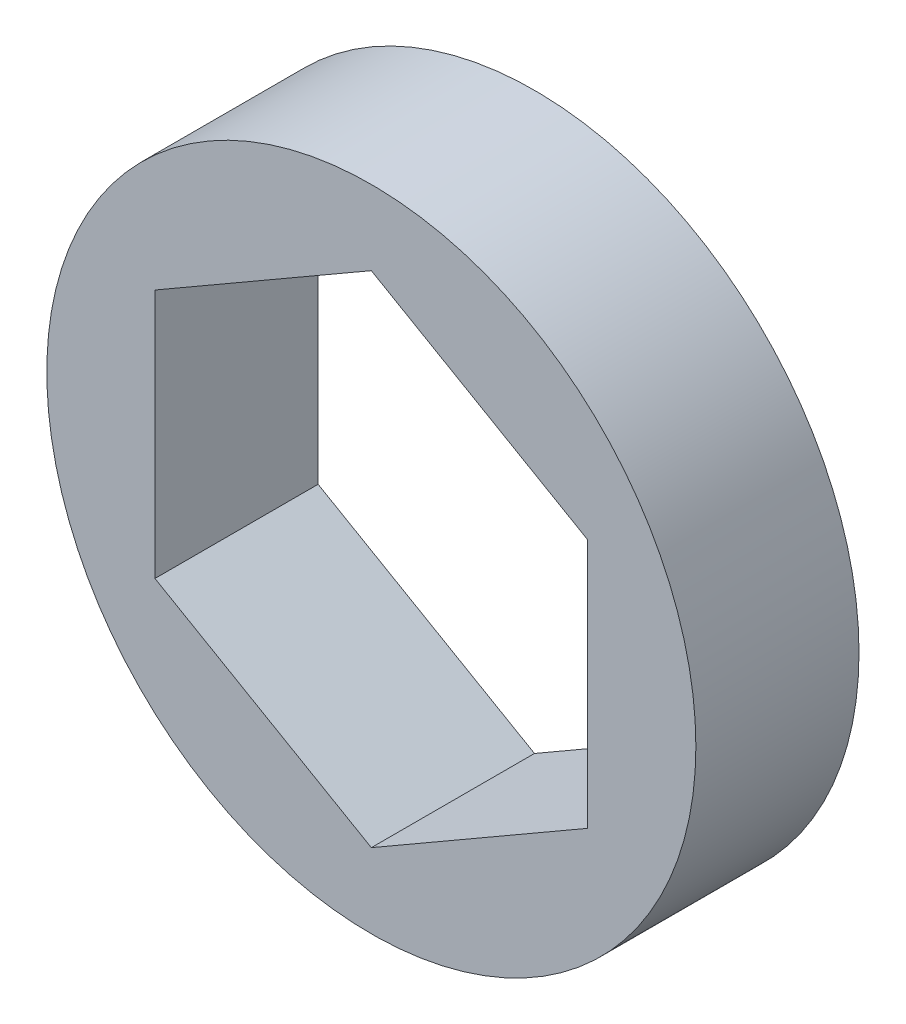
from build123d import *

# Parameters (mm, degrees)
SKETCH1_R           = 9.525
BOSS_EXTRUDE1_DEPTH = 4.7879


with BuildPart() as part:
    # Sketch1 → Boss-Extrude1 (new body)
    with BuildSketch(Plane.XY):
        Circle(SKETCH1_R)
        Polygon((0, 7.332348419), (-6.35, 3.666174209), (-6.35, -3.666174209), (0, -7.332348419), (6.35, -3.666174209), (6.35, 3.666174209), align=None, mode=Mode.SUBTRACT)
    extrude(amount=BOSS_EXTRUDE1_DEPTH)


solid = part.part
